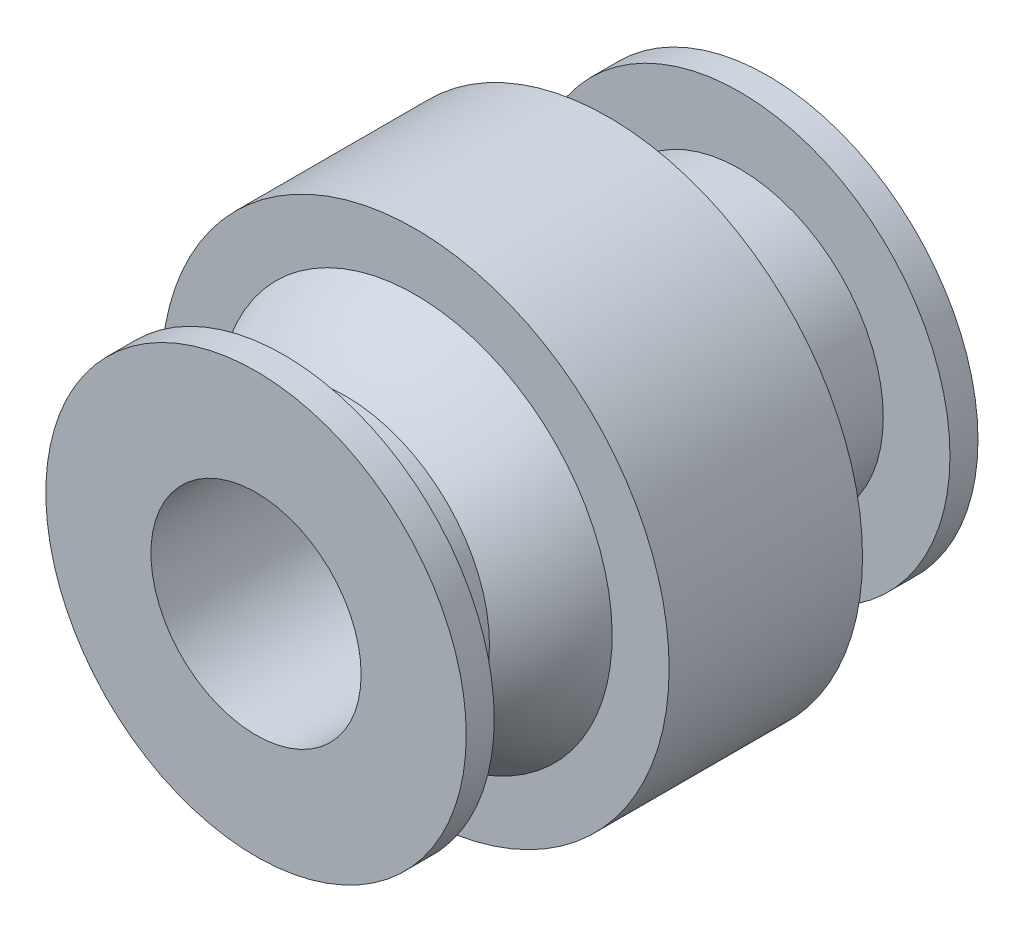
from build123d import *


with BuildPart() as part:
    # Sketch1 → Revolve1 (revolve)
    with BuildSketch(Plane(origin=(0, 0, 0), x_dir=(0, 0, -1), z_dir=(1, 0, 0)), mode=Mode.PRIVATE) as revolve1_sk:
        with BuildLine():
            Line((60.7949, -26.811732), (81.4451, -26.811732))
            Line((81.4451, -26.811732), (82.7151, -26.811732))
            Line((82.7151, -26.811732), (82.7151, -31.574232))
            Line((82.7151, -31.574232), (81.4451, -31.574232))
            Line((81.4451, -31.574232), (81.4451, -28.551632))
            Line((81.4451, -28.551632), (78.639993039, -28.551632))
            ThreePointArc((78.639993039, -28.551632), (77.1926569, -29.920339878), (75.5015, -30.973018125))
            Line((75.5015, -30.973018125), (75.5015, -33.555432))
            Line((75.5015, -33.555432), (66.7385, -33.555432))
            Line((66.7385, -33.555432), (66.7385, -30.973018125))
            ThreePointArc((66.7385, -30.973018125), (65.0473431, -29.920339878), (63.600006961, -28.551632))
            Line((63.600006961, -28.551632), (60.7949, -28.551632))
            Line((60.7949, -28.551632), (60.7949, -31.574232))
            Line((60.7949, -31.574232), (59.5249, -31.574232))
            Line((59.5249, -31.574232), (59.5249, -26.811732))
            Line((59.5249, -26.811732), (60.7949, -26.811732))
        make_face()
    revolve(revolve1_sk.sketch.rotate(Axis((0, -22.049232, -82.136173087), (0, 0, -1)), 270), axis=Axis((0, -22.049232, -82.136173087), (0, 0, -1)))


solid = part.part
